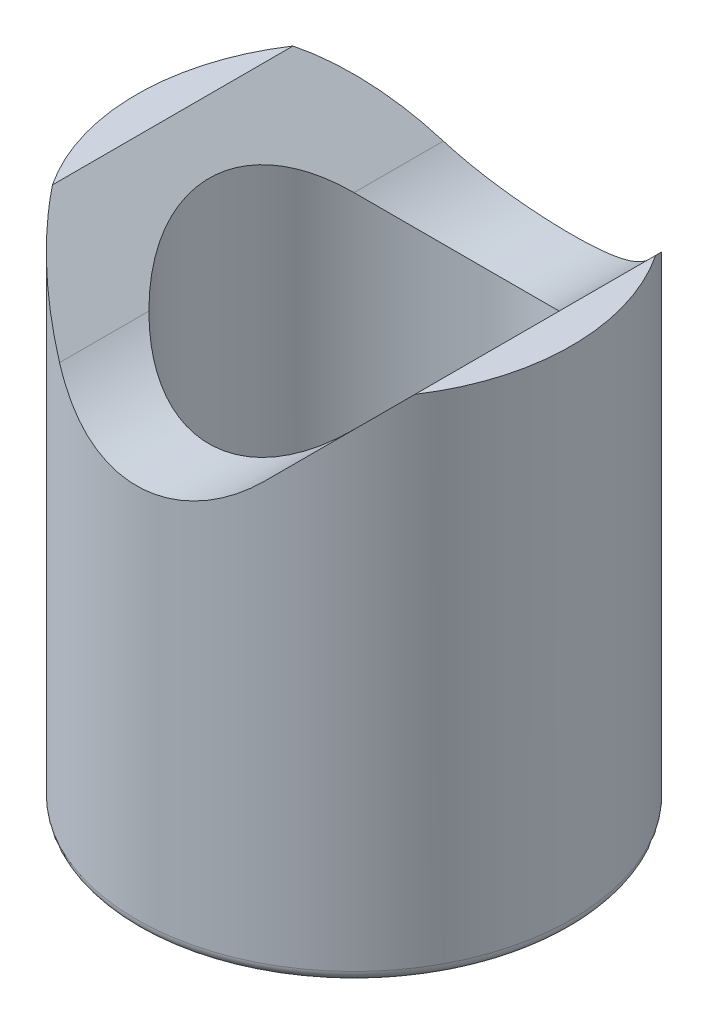
from build123d import *

# Parameters (mm, degrees)
SKETCH_1_R               = 6
SKETCH_1_R_2             = 4
EXTRUDE_1_DEPTH          = 15
CUT_EXTRUDE_1_DEPTH      = 18.23368794
CUT_EXTRUDE_1_DEPTH_BACK = 18.23368794
FILLET_1_R               = 0.3


with BuildPart() as part:
    # Эскиз1 → Бобышка-Вытянуть1 (new body)
    with BuildSketch(Plane(origin=(0, 0, 0), x_dir=(1, 0, 0), z_dir=(0, 1, 0))):
        with Locations(Location((0, 0, 0), (0, 0, 270))):
            Circle(SKETCH_1_R)
        with Locations(Location((0, 0, 0), (0, 0, 270))):
            Circle(SKETCH_1_R_2, mode=Mode.SUBTRACT)
    extrude(amount=EXTRUDE_1_DEPTH)

    # Эскиз2 → Вырез-Вытянуть1 (cut, two sides: drawn at the far end of the back side and taken through both)
    with BuildSketch(Plane.XY.offset(-CUT_EXTRUDE_1_DEPTH_BACK)):
        with BuildLine():
            Line((5, 14), (2.828427125, 11.828427125))
            ThreePointArc((2.828427125, 11.828427125), (0, 10.656854249), (-2.828427125, 11.828427125))
            Line((-2.828427125, 11.828427125), (-5, 14))
            Line((-5, 14), (-7.91663408, 14))
            Line((-7.91663408, 14), (-7.91663408, 18.742378879))
            Line((-7.91663408, 18.742378879), (8.078053183, 18.742378879))
            Line((8.078053183, 18.742378879), (8.078053183, 14))
            Line((8.078053183, 14), (5, 14))
        make_face()
    extrude(amount=CUT_EXTRUDE_1_DEPTH + CUT_EXTRUDE_1_DEPTH_BACK, mode=Mode.SUBTRACT)

    # Скругление1
    fillet_1_edges = [part.edges().sort_by_distance(p)[0] for p in [
        (0, 0, -6),
    ]]
    fillet(fillet_1_edges, radius=FILLET_1_R)


solid = part.part
